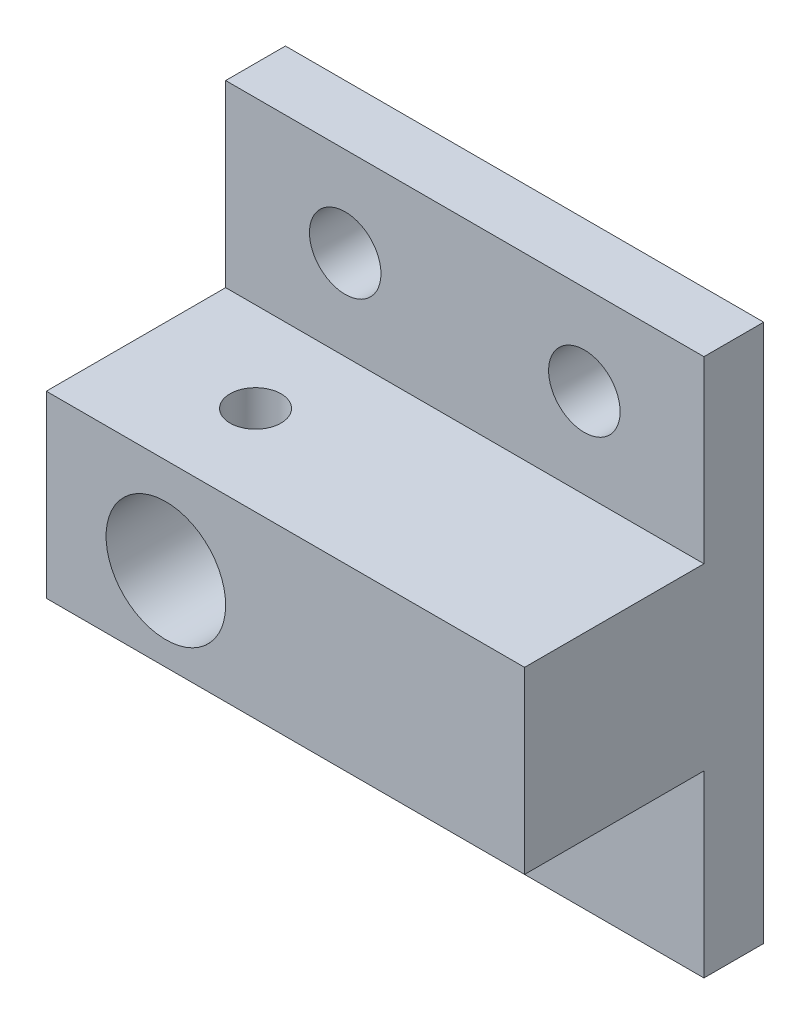
from build123d import *

# Parameters (mm, degrees)
SKETCH1_W                  = 25.4
SKETCH1_H                  = 28.575
BOSS_EXTRUDE1_DEPTH        = 12.7
SKETCH3_W                  = 25.4
SKETCH3_H                  = 9.525
CUT_EXTRUDE1_DEPTH         = 9.525
SKETCH2_R                  = 3.175
CUT_EXTRUDE2_DEPTH         = 23.950221268
F_6_32_TAPPED_HOLE1_REACH  = 28.182
F_6_32_TAPPED_HOLE1_BORE_R = 1.35255
F_6_CLEARANCE_HOLE1_D      = 3.7973


with BuildPart() as part:
    # Sketch1 → Boss-Extrude1 (new body)
    with BuildSketch(Plane.XY):
        Rectangle(SKETCH1_W, SKETCH1_H)
    extrude(amount=BOSS_EXTRUDE1_DEPTH)

    # Sketch3 → Cut-Extrude1 (cut)
    with BuildSketch(Plane.XY.offset(12.7)):
        with Locations((0, -9.525)):
            Rectangle(SKETCH3_W, SKETCH3_H)
        with Locations((0, 9.525)):
            Rectangle(SKETCH3_W, SKETCH3_H)
    extrude(amount=-CUT_EXTRUDE1_DEPTH, mode=Mode.SUBTRACT)

    # Sketch2 → Cut-Extrude2 (cut, through all)
    with BuildSketch(Plane.XY.offset(12.7)):
        with Locations((-6.35, -0.3175)):
            Circle(SKETCH2_R)
    extrude(amount=-CUT_EXTRUDE2_DEPTH, mode=Mode.SUBTRACT)

    # #6-32 Tapped Hole1 bore → #6-32 Tapped Hole1 (cut, up to next)
    with BuildSketch(Plane(origin=(0, 4.7625, 0), x_dir=(1, 0, 0), z_dir=(0, 1, 0)), mode=Mode.PRIVATE) as f_6_32_tapped_hole1_sk1:
        with Locations((-6.35, -7.9375)):
            Circle(F_6_32_TAPPED_HOLE1_BORE_R)
    f_6_32_tapped_hole1_tool1 = extrude(f_6_32_tapped_hole1_sk1.sketch, amount=-F_6_32_TAPPED_HOLE1_REACH, mode=Mode.PRIVATE) & part.part
    add(f_6_32_tapped_hole1_tool1.solids().sort_by_distance((-6.35, 4.7625, 7.9375))[0], mode=Mode.SUBTRACT)

    # #6 Clearance Hole1 (through all)
    with Locations(Plane.XY.offset(3.175)):
        with Locations((-6.35, 9.525), (6.35, 9.525), (-6.35, -8.5725)):
            Hole(F_6_CLEARANCE_HOLE1_D / 2)


solid = part.part
